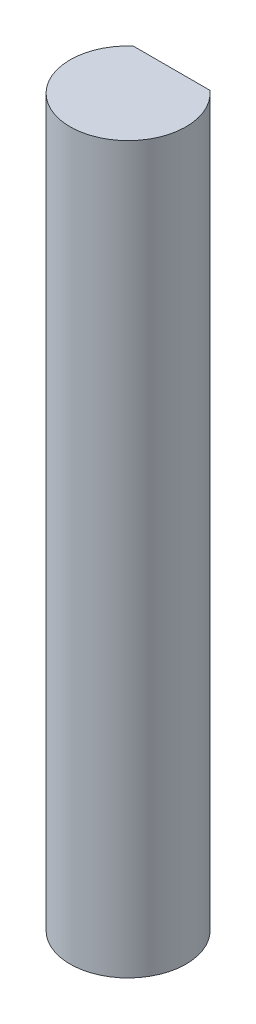
from build123d import *

# Parameters (mm, degrees)
BOSS_EXTRUDE1_DEPTH = 25


with BuildPart() as part:
    # Sketch1 → Boss-Extrude1 (new body)
    with BuildSketch(Plane(origin=(0, 0, 0), x_dir=(1, 0, 0), z_dir=(0, 1, 0))):
        with BuildLine():
            Line((-1.322875656, 1.5), (1.322875656, 1.5))
            ThreePointArc((1.322875656, 1.5), (0, -2), (-1.322875656, 1.5))
        make_face()
    extrude(amount=BOSS_EXTRUDE1_DEPTH)


solid = part.part
